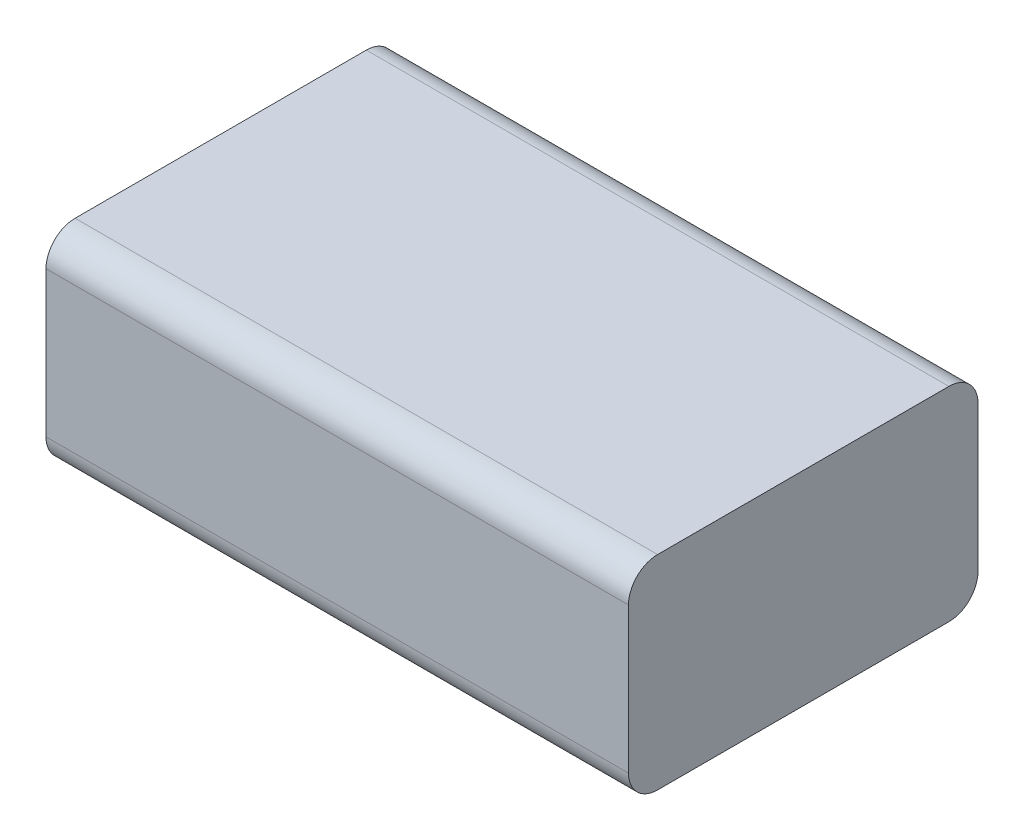
from build123d import *

# Parameters (mm, degrees)
SKETCH1_W           = 100
SKETCH1_H           = 60
BOSS_EXTRUDE1_DEPTH = 35
FILLET1_R           = 5
FILLET2_R           = 5
FILLET3_R           = 5
FILLET4_R           = 5


with BuildPart() as part:
    # Sketch1 → Boss-Extrude1 (new body)
    with BuildSketch(Plane(origin=(0, 0, 0), x_dir=(1, 0, 0), z_dir=(0, 1, 0))):
        Rectangle(SKETCH1_W, SKETCH1_H)
    extrude(amount=BOSS_EXTRUDE1_DEPTH)

    # Fillet1
    fillet1_edges = [part.edges().sort_by_distance(p)[0] for p in [
        (0, 35, 30),
    ]]
    fillet(fillet1_edges, radius=FILLET1_R)

    # Fillet2
    fillet2_edges = [part.edges().sort_by_distance(p)[0] for p in [
        (0, 35, -30),
    ]]
    fillet(fillet2_edges, radius=FILLET2_R)

    # Fillet3
    fillet3_edges = [part.edges().sort_by_distance(p)[0] for p in [
        (0, 0, 30),
    ]]
    fillet(fillet3_edges, radius=FILLET3_R)

    # Fillet4
    fillet4_edges = [part.edges().sort_by_distance(p)[0] for p in [
        (0, 0, -30),
    ]]
    fillet(fillet4_edges, radius=FILLET4_R)


solid = part.part
